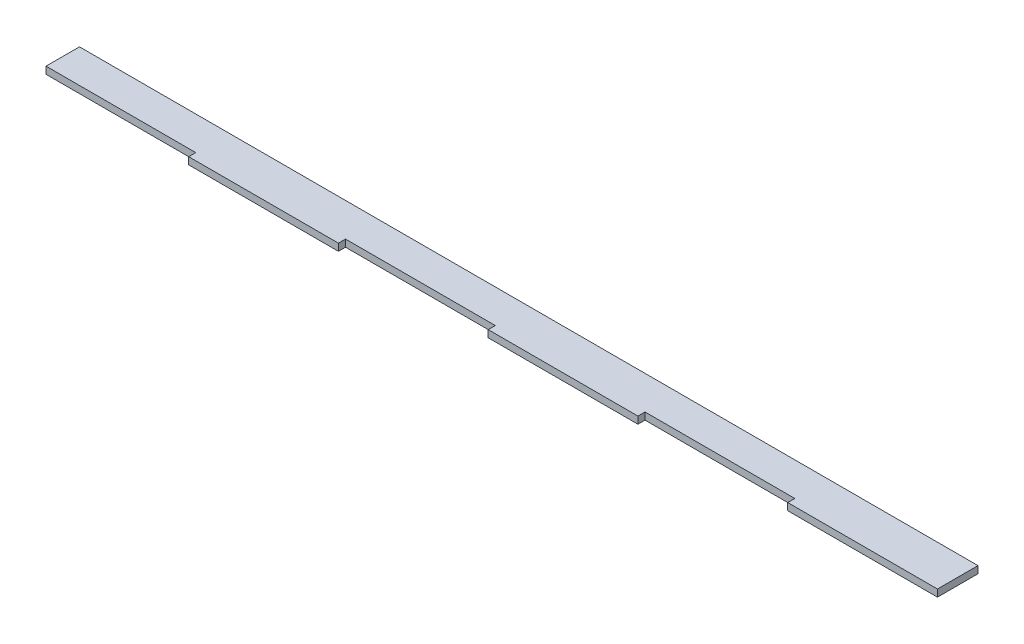
from build123d import *

# Parameters (mm, degrees)
BOSS_EXTRUDE1_DEPTH = 3.175


with BuildPart() as part:
    # Sketch1 → Boss-Extrude1 (new body)
    with BuildSketch(Plane(origin=(0, 0, 0), x_dir=(1, 0, 0), z_dir=(0, 1, 0))):
        Polygon((0, 0), (67.14, 0), (67.14, -3.175), (134.28, -3.175), (134.28, 0), (201.42, 0), (201.42, -3.175), (268.56, -3.175), (268.56, 0), (335.7, 0), (335.7, -3.175), (402.84, -3.175), (402.84, 0), (402.84, 15), (0, 15), align=None)
    extrude(amount=BOSS_EXTRUDE1_DEPTH)


solid = part.part
